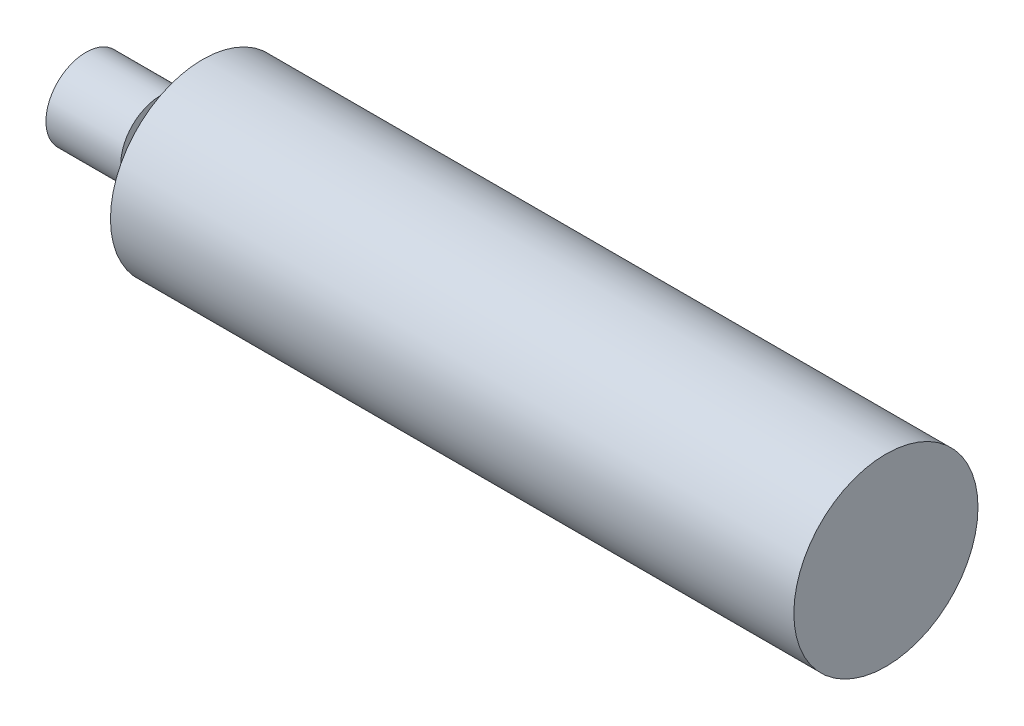
from build123d import *


with BuildPart() as part:
    # Sketch1 → Revolve1 (revolve)
    with BuildSketch(Plane(origin=(0, 0, 0), x_dir=(1, 0, 0), z_dir=(0, 1, 0))):
        Polygon((0, 0), (0, 4.7625), (8.922, 4.7625), (8.922, 2.9972), (10.922, 2.9972), (10.922, 6.0071), (13.922, 6.0071), (13.922, 10.9855), (95.456, 10.9855), (95.456, 0), align=None)
    revolve(axis=Axis((95.456, 0, 0), (-1, 0, 0)))


solid = part.part
